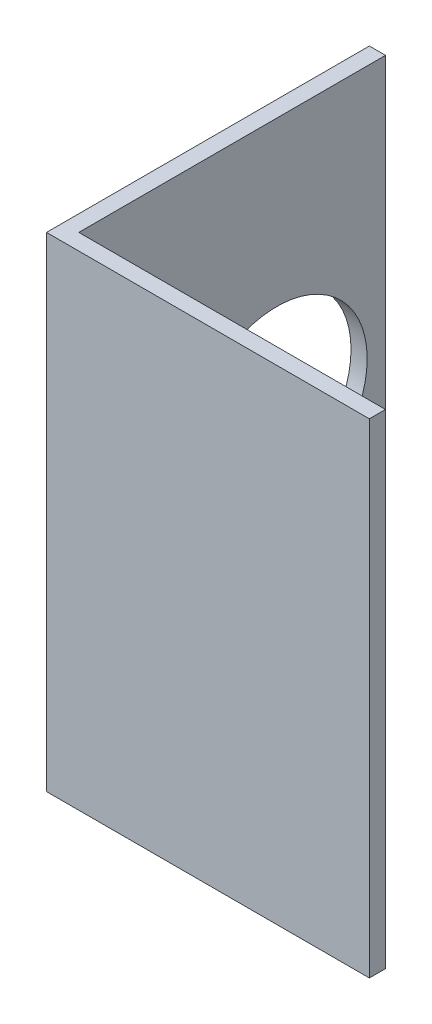
from build123d import *

# Parameters (mm, degrees)
EXTRUDE1_DEPTH = 76.2
SKETCH3_R      = 14.224
EXTRUDE3_DEPTH = 95.19774279


with BuildPart() as part:
    # Sketch1 → Extrude1 (new body)
    with BuildSketch(Plane(origin=(0, 0, 0), x_dir=(1, 0, 0), z_dir=(0, 1, 0))):
        Polygon((-20.623588442, 27.161501186), (-20.623588442, -23.638498814), (30.176411558, -23.638498814), (30.176411558, -21.098498814), (-18.083588442, -21.098498814), (-18.083588442, 27.161501186), align=None)
    extrude(amount=EXTRUDE1_DEPTH)

    # Sketch3 → Extrude3 (cut, through all)
    with BuildSketch(Plane(origin=(-18.083588442, 0, 0), x_dir=(0, 0, -1), z_dir=(1, 0, 0))):
        with Locations((10.05322198, 36.299823775)):
            Circle(SKETCH3_R)
    extrude(amount=-EXTRUDE3_DEPTH, mode=Mode.SUBTRACT)


solid = part.part
